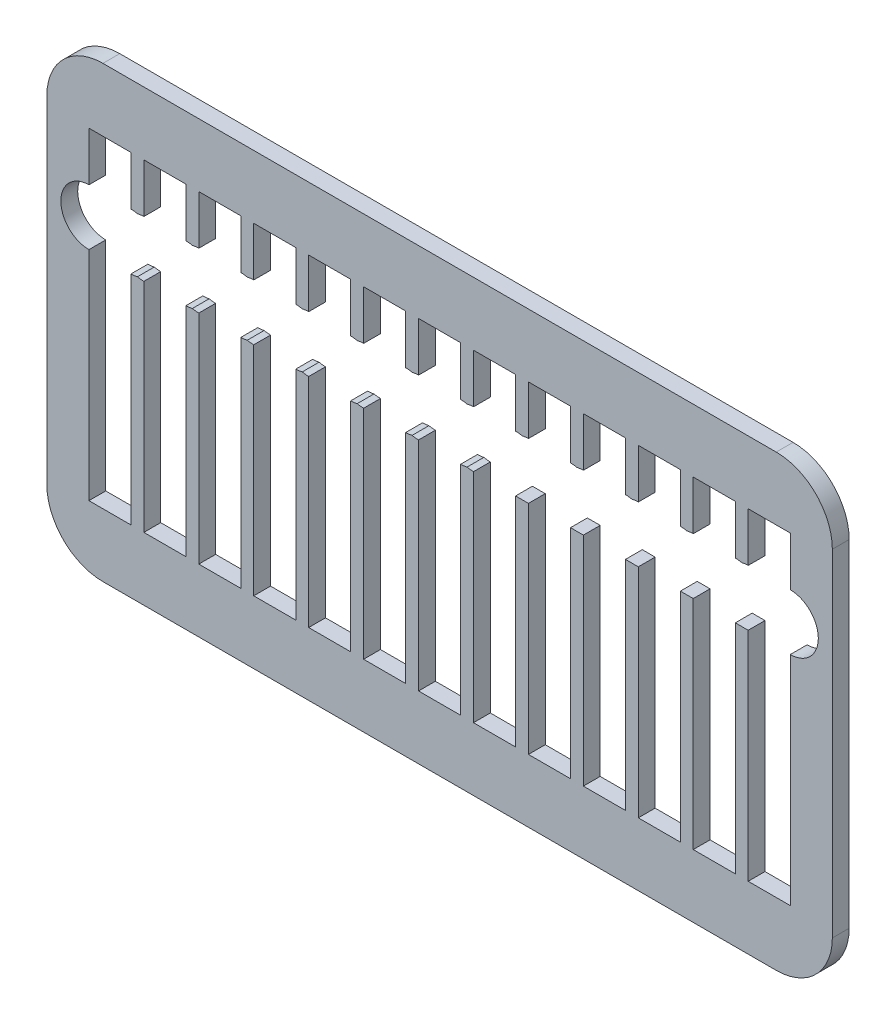
from build123d import *

# Parameters (mm, degrees)
BOSS_EXTRUDE1_DEPTH = 6
CUT_EXTRUDE1_DEPTH  = 6


with BuildPart() as part:
    # Sketch1 → Boss-Extrude1 (new body)
    with BuildSketch(Plane.XY):
        with BuildLine():
            Line((20, 0), (260, 0))
            ThreePointArc((260, 0), (274.142135624, 5.857864376), (280, 20))
            Line((280, 20), (280, 140))
            ThreePointArc((280, 140), (274.142135624, 154.142135624), (260, 160))
            Line((260, 160), (20, 160))
            ThreePointArc((20, 160), (5.857864376, 154.142135624), (0, 140))
            Line((0, 140), (0, 20))
            ThreePointArc((0, 20), (5.857864376, 5.857864376), (20, 0))
        make_face()
    extrude(amount=BOSS_EXTRUDE1_DEPTH)

    # Sketch2 → Cut-Extrude1 (cut)
    with BuildSketch(Plane.XY.offset(6)):
        with BuildLine():
            Line((15, 137.5), (30, 137.5))
            Line((30, 137.5), (30, 120))
            ThreePointArc((30, 120), (31.153533726, 119.933245187), (32.291666667, 119.733871989))
            ThreePointArc((32.291666667, 119.733871989), (33.429799607, 119.933245187), (34.583333333, 120))
            Line((34.583333333, 120), (34.583333333, 137.5))
            Line((34.583333333, 137.5), (49.583333333, 137.5))
            Line((49.583333333, 137.5), (49.583333333, 120))
            ThreePointArc((49.583333333, 120), (50.736867059, 119.933245187), (51.875, 119.733871989))
            ThreePointArc((51.875, 119.733871989), (53.013132941, 119.933245187), (54.166666667, 120))
            Line((54.166666667, 120), (54.166666667, 137.5))
            Line((54.166666667, 137.5), (69.166666667, 137.5))
            Line((69.166666667, 137.5), (69.166666667, 120))
            ThreePointArc((69.166666667, 120), (70.320200393, 119.933245187), (71.458333333, 119.733871989))
            ThreePointArc((71.458333333, 119.733871989), (72.596466274, 119.933245187), (73.75, 120))
            Line((73.75, 120), (73.75, 137.5))
            Line((73.75, 137.5), (88.75, 137.5))
            Line((88.75, 137.5), (88.75, 120))
            ThreePointArc((88.75, 120), (89.903533726, 119.933245187), (91.041666667, 119.733871989))
            ThreePointArc((91.041666667, 119.733871989), (92.179799607, 119.933245187), (93.333333333, 120))
            Line((93.333333333, 120), (93.333333333, 137.5))
            Line((93.333333333, 137.5), (108.333333333, 137.5))
            Line((108.333333333, 137.5), (108.333333333, 120))
            ThreePointArc((108.333333333, 120), (109.486867059, 119.933245187), (110.625, 119.733871989))
            ThreePointArc((110.625, 119.733871989), (111.763132941, 119.933245187), (112.916666667, 120))
            Line((112.916666667, 120), (112.916666667, 137.5))
            Line((112.916666667, 137.5), (127.916666667, 137.5))
            Line((127.916666667, 137.5), (127.916666667, 120))
            ThreePointArc((127.916666667, 120), (129.070200393, 119.933245187), (130.208333333, 119.733871989))
            ThreePointArc((130.208333333, 119.733871989), (131.346466274, 119.933245187), (132.5, 120))
            Line((132.5, 120), (132.5, 137.5))
            Line((132.5, 137.5), (147.5, 137.5))
            Line((147.5, 137.5), (147.5, 120))
            ThreePointArc((147.5, 120), (148.653533726, 119.933245187), (149.791666667, 119.733871989))
            ThreePointArc((149.791666667, 119.733871989), (150.929799607, 119.933245187), (152.083333333, 120))
            Line((152.083333333, 120), (152.083333333, 137.5))
            Line((152.083333333, 137.5), (167.083333333, 137.5))
            Line((167.083333333, 137.5), (167.083333333, 120))
            ThreePointArc((167.083333333, 120), (168.236867059, 119.933245187), (169.375, 119.733871989))
            ThreePointArc((169.375, 119.733871989), (170.513132941, 119.933245187), (171.666666667, 120))
            Line((171.666666667, 120), (171.666666667, 137.5))
            Line((171.666666667, 137.5), (186.666666667, 137.5))
            Line((186.666666667, 137.5), (186.666666667, 120))
            ThreePointArc((186.666666667, 120), (187.820200393, 119.933245187), (188.958333333, 119.733871989))
            ThreePointArc((188.958333333, 119.733871989), (190.096466274, 119.933245187), (191.25, 120))
            Line((191.25, 120), (191.25, 137.5))
            Line((191.25, 137.5), (206.25, 137.5))
            Line((206.25, 137.5), (206.25, 120))
            ThreePointArc((206.25, 120), (207.403533726, 119.933245187), (208.541666667, 119.733871989))
            ThreePointArc((208.541666667, 119.733871989), (209.679799607, 119.933245187), (210.833333333, 120))
            Line((210.833333333, 120), (210.833333333, 137.5))
            Line((210.833333333, 137.5), (225.833333333, 137.5))
            Line((225.833333333, 137.5), (225.833333333, 120))
            ThreePointArc((225.833333333, 120), (226.986867059, 119.933245187), (228.125, 119.733871989))
            ThreePointArc((228.125, 119.733871989), (229.263132941, 119.933245187), (230.416666667, 120))
            Line((230.416666667, 120), (230.416666667, 137.5))
            Line((230.416666667, 137.5), (245.416666667, 137.5))
            Line((245.416666667, 137.5), (245.416666667, 120))
            ThreePointArc((245.416666667, 120), (246.570200393, 119.933245187), (247.708333333, 119.733871989))
            ThreePointArc((247.708333333, 119.733871989), (248.846466274, 119.933245187), (250, 120))
            Line((250, 120), (250, 137.5))
            Line((250, 137.5), (265, 137.5))
            Line((265, 137.5), (265, 120))
            ThreePointArc((265, 120), (275, 110), (265, 100))
            Line((265, 100), (265, 22.5))
            Line((265, 22.5), (250, 22.5))
            Line((250, 22.5), (250, 100))
            Line((250, 100), (245.416666667, 100))
            Line((245.416666667, 100), (245.416666667, 22.5))
            Line((245.416666667, 22.5), (230.416666667, 22.5))
            Line((230.416666667, 22.5), (230.416666667, 100))
            Line((230.416666667, 100), (225.833333333, 100))
            Line((225.833333333, 100), (225.833333333, 22.5))
            Line((225.833333333, 22.5), (210.833333333, 22.5))
            Line((210.833333333, 22.5), (210.833333333, 100))
            Line((210.833333333, 100), (206.25, 100))
            Line((206.25, 100), (206.25, 22.5))
            Line((206.25, 22.5), (191.25, 22.5))
            Line((191.25, 22.5), (191.25, 100))
            Line((191.25, 100), (186.666666667, 100))
            Line((186.666666667, 100), (186.666666667, 22.5))
            Line((186.666666667, 22.5), (171.666666667, 22.5))
            Line((171.666666667, 22.5), (171.666666667, 100))
            Line((171.666666667, 100), (167.083333333, 100))
            Line((167.083333333, 100), (167.083333333, 22.5))
            Line((167.083333333, 22.5), (152.083333333, 22.5))
            Line((152.083333333, 22.5), (152.083333333, 100))
            ThreePointArc((152.083333333, 100), (150.929799607, 100.066754813), (149.791666667, 100.266128011))
            ThreePointArc((149.791666667, 100.266128011), (148.653533726, 100.066754813), (147.5, 100))
            Line((147.5, 100), (147.5, 22.5))
            Line((147.5, 22.5), (132.5, 22.5))
            Line((132.5, 22.5), (132.5, 100))
            ThreePointArc((132.5, 100), (131.346466274, 100.066754813), (130.208333333, 100.266128011))
            ThreePointArc((130.208333333, 100.266128011), (129.070200393, 100.066754813), (127.916666667, 100))
            Line((127.916666667, 100), (127.916666667, 22.5))
            Line((127.916666667, 22.5), (112.916666667, 22.5))
            Line((112.916666667, 22.5), (112.916666667, 100))
            ThreePointArc((112.916666667, 100), (111.763132941, 100.066754813), (110.625, 100.266128011))
            ThreePointArc((110.625, 100.266128011), (109.486867059, 100.066754813), (108.333333333, 100))
            Line((108.333333333, 100), (108.333333333, 22.5))
            Line((108.333333333, 22.5), (93.333333333, 22.5))
            Line((93.333333333, 22.5), (93.333333333, 100))
            ThreePointArc((93.333333333, 100), (92.179799607, 100.066754813), (91.041666667, 100.266128011))
            ThreePointArc((91.041666667, 100.266128011), (89.903533726, 100.066754813), (88.75, 100))
            Line((88.75, 100), (88.75, 22.5))
            Line((88.75, 22.5), (73.75, 22.5))
            Line((73.75, 22.5), (73.75, 100))
            ThreePointArc((73.75, 100), (72.596466274, 100.066754813), (71.458333333, 100.266128011))
            ThreePointArc((71.458333333, 100.266128011), (70.320200393, 100.066754813), (69.166666667, 100))
            Line((69.166666667, 100), (69.166666667, 22.5))
            Line((69.166666667, 22.5), (54.166666667, 22.5))
            Line((54.166666667, 22.5), (54.166666667, 100))
            ThreePointArc((54.166666667, 100), (53.013132941, 100.066754813), (51.875, 100.266128011))
            ThreePointArc((51.875, 100.266128011), (50.736867059, 100.066754813), (49.583333333, 100))
            Line((49.583333333, 100), (49.583333333, 22.5))
            Line((49.583333333, 22.5), (34.583333333, 22.5))
            Line((34.583333333, 22.5), (34.583333333, 100))
            ThreePointArc((34.583333333, 100), (33.429799607, 100.066754813), (32.291666667, 100.266128011))
            ThreePointArc((32.291666667, 100.266128011), (31.153533726, 100.066754813), (30, 100))
            Line((30, 100), (30, 22.5))
            Line((30, 22.5), (15, 22.5))
            Line((15, 22.5), (15, 100))
            ThreePointArc((15, 100), (5, 110), (15, 120))
            Line((15, 120), (15, 137.5))
        make_face()
    extrude(amount=-CUT_EXTRUDE1_DEPTH, mode=Mode.SUBTRACT)


solid = part.part
